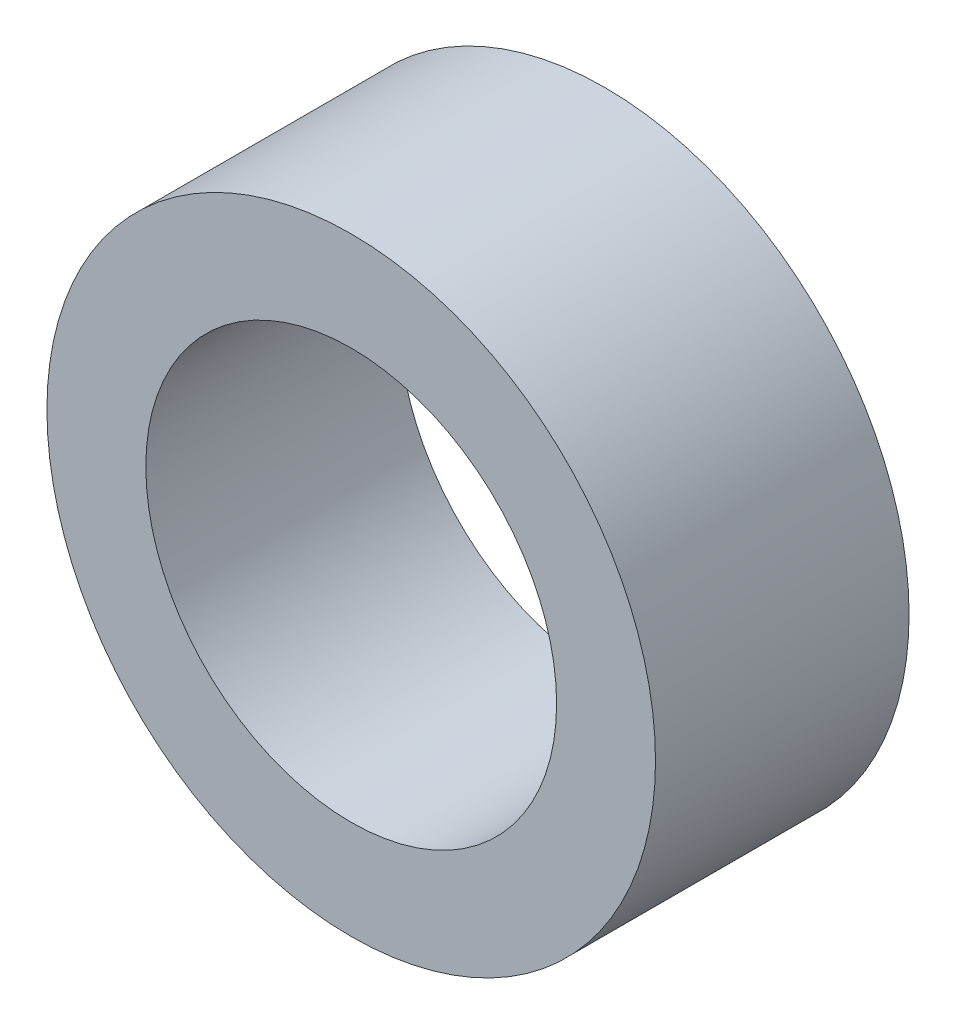
from build123d import *

# Parameters (mm, degrees)
SKETCH1_R           = 6
SKETCH1_R_2         = 4.05
BOSS_EXTRUDE1_DEPTH = 5


with BuildPart() as part:
    # Sketch1 → Boss-Extrude1 (new body)
    with BuildSketch(Plane.XY):
        Circle(SKETCH1_R)
        Circle(SKETCH1_R_2, mode=Mode.SUBTRACT)
    extrude(amount=BOSS_EXTRUDE1_DEPTH)


solid = part.part
